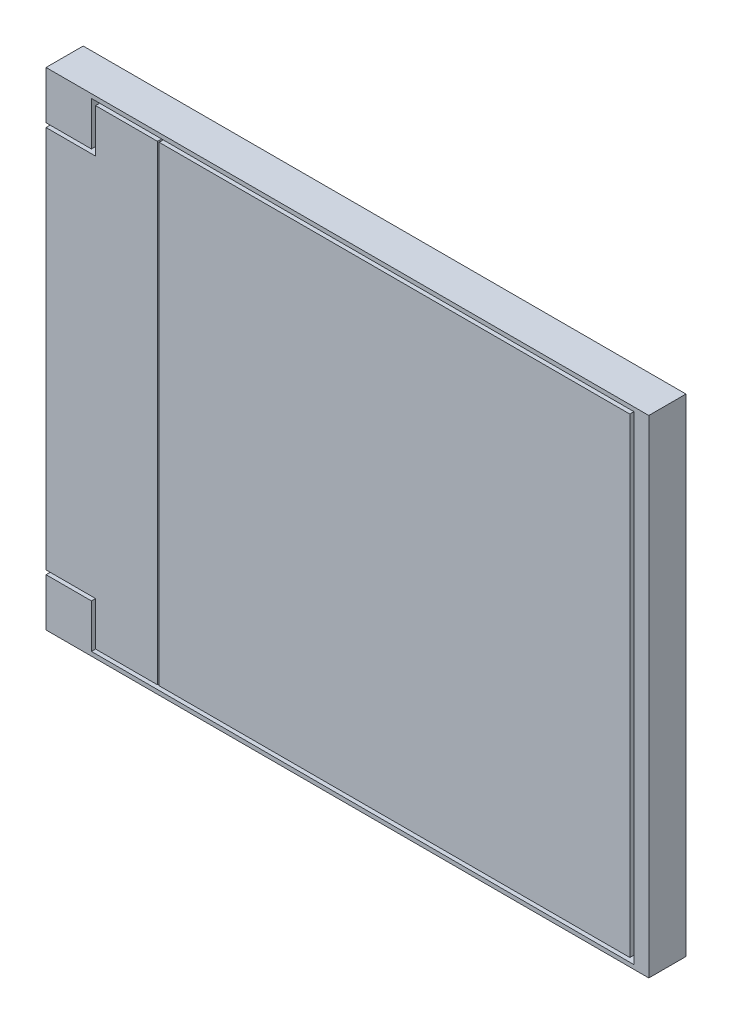
from build123d import *

# Parameters (mm, degrees)
EXTRUDE_938_DEPTH  = 2.25
EXTRUDE_987_DEPTH  = 0.1
SKETCH_1488_W      = 28.5
SKETCH_1488_H      = 28.5
EXTRUDE_2115_DEPTH = 2.15
SKETCH_2253_W      = 1.5
SKETCH_2253_H      = 0.4
EXTRUDE_2914_DEPTH = 0.01


with BuildPart() as part:
    # Sketch 282 → Extrude 938 (new body)
    with BuildSketch(Plane.XY):
        Polygon((36.5, 29.5), (0, 29.5), (0, 26.6), (2.75, 26.6), (2.75, 29.25), (35.6, 29.25), (35.6, 0.25), (2.75, 0.25), (2.75, 2.9), (0, 2.9), (0, 0), (36.5, 0), align=None)
    extrude(amount=EXTRUDE_938_DEPTH)

    # 底面草图<3> → Extrude 987 (add)
    with BuildSketch(Plane.XY):
        Polygon((2.75, 26.6), (0, 26.6), (0, 2.9), (2.75, 2.9), (2.75, 0.25), (35.6, 0.25), (35.6, 29.25), (2.75, 29.25), align=None)
    extrude(amount=EXTRUDE_987_DEPTH)

    # Sketch 1488 → Extrude 2115 (add)
    with BuildSketch(Plane.XY.offset(0.1)):
        with Locations((21.1, 14.75)):
            Rectangle(SKETCH_1488_W, SKETCH_1488_H)
        Polygon((6.75, 0.5), (6.75, 29), (3, 29), (3, 26.35), (0, 26.35), (0, 3.15), (3, 3.15), (3, 0.5), align=None)
    extrude(amount=EXTRUDE_2115_DEPTH)

    # Sketch 2253 → Extrude 2914 (add)
    with BuildSketch(Plane(origin=(0, 0, 0), x_dir=(-1, 0, 0), z_dir=(0, 0, -1))):
        with Locations((-8.05, 9.55)):
            Rectangle(SKETCH_2253_W, SKETCH_2253_H)
        with Locations((-8.05, 19.95)):
            Rectangle(SKETCH_2253_W, SKETCH_2253_H)
    extrude(amount=EXTRUDE_2914_DEPTH)


solid = part.part
